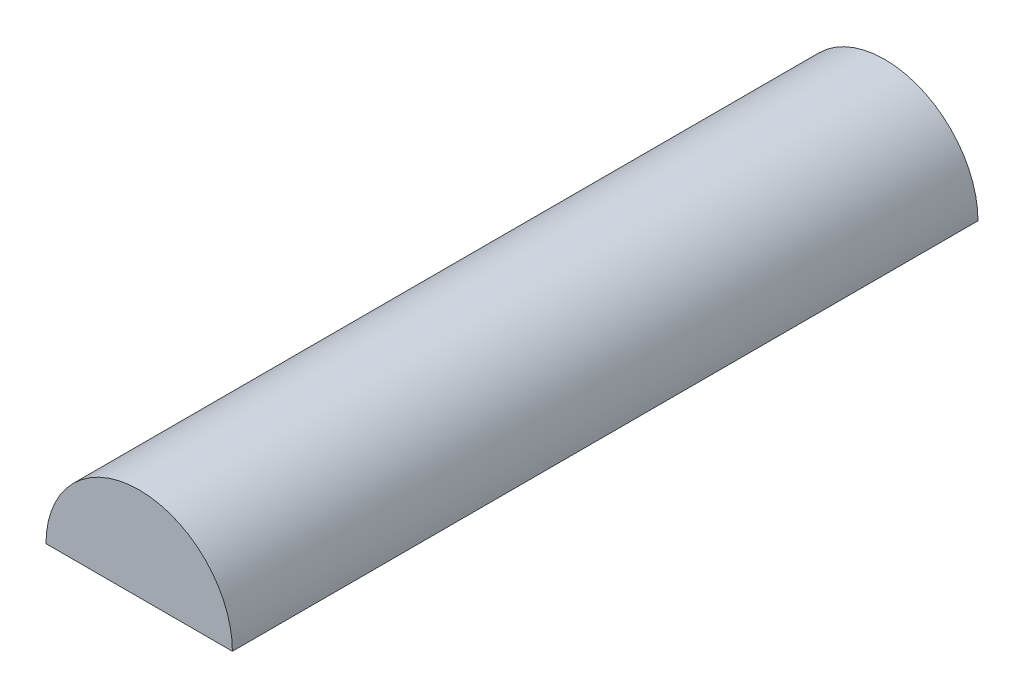
from build123d import *

# Parameters (mm, degrees)
EXTRUDE_1_DEPTH = 100


with BuildPart() as part:
    # Эскиз1 → Бобышка-Вытянуть1 (new body)
    with BuildSketch(Plane.XY):
        with BuildLine():
            ThreePointArc((0, 0), (12.5, 12.5), (25, 0))
            Line((25, 0), (0, 0))
        make_face()
    extrude(amount=EXTRUDE_1_DEPTH)


solid = part.part
